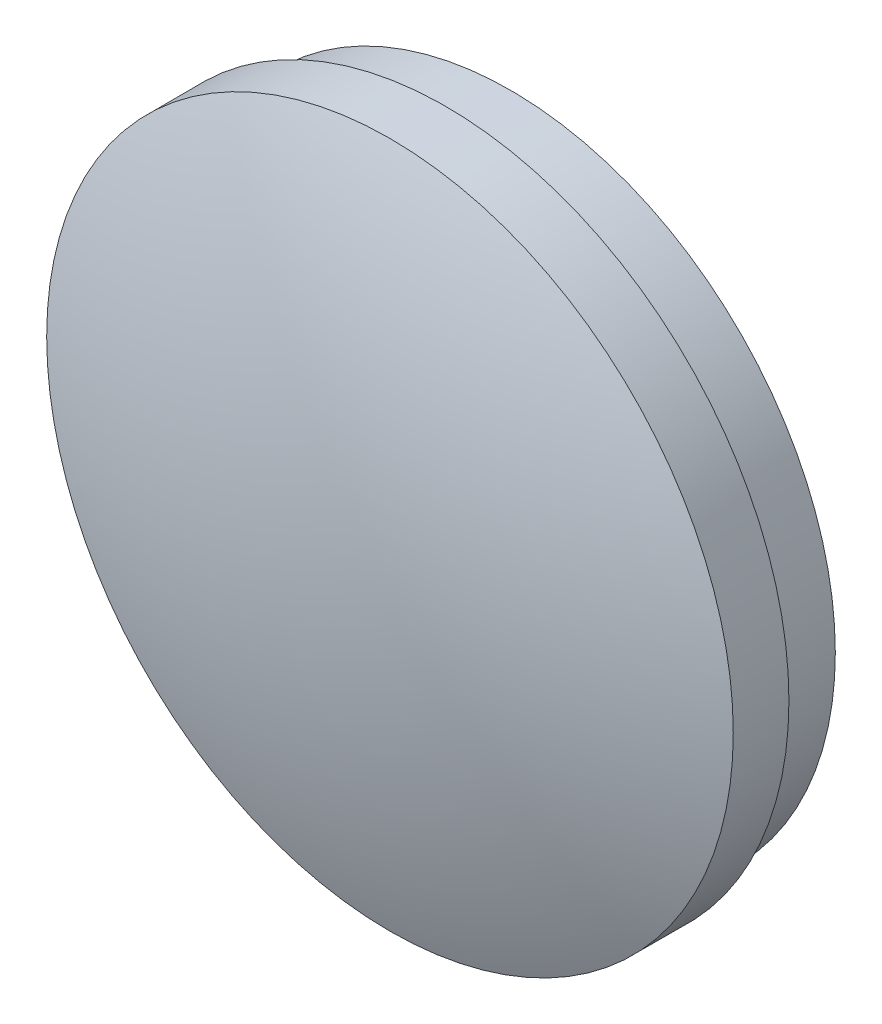
from build123d import *


with BuildPart() as part:
    # Sketch1 → Revolve1 (revolve)
    with BuildSketch(Plane(origin=(0, 0, 0), x_dir=(0, 0, -1), z_dir=(1, 0, 0)), mode=Mode.PRIVATE) as revolve1_sk:
        with BuildLine():
            Line((8, 0), (8, 6))
            Line((8, 6), (0, 6))
            Line((0, 6), (0, 17.5))
            Line((0, 17.5), (-3.5, 17.5))
            Line((-3.5, 17.5), (-3.5, 18.5))
            Line((-3.5, 18.5), (-6.5, 18.5))
            ThreePointArc((-6.5, 18.5), (-9.117307443, 9.414085192), (-10, 0))
            Line((-10, 0), (8, 0))
        make_face()
    revolve(revolve1_sk.sketch.rotate(Axis((0, 0, -8), (0, 0, -1)), 90), axis=Axis((0, 0, -8), (0, 0, -1)))


solid = part.part
